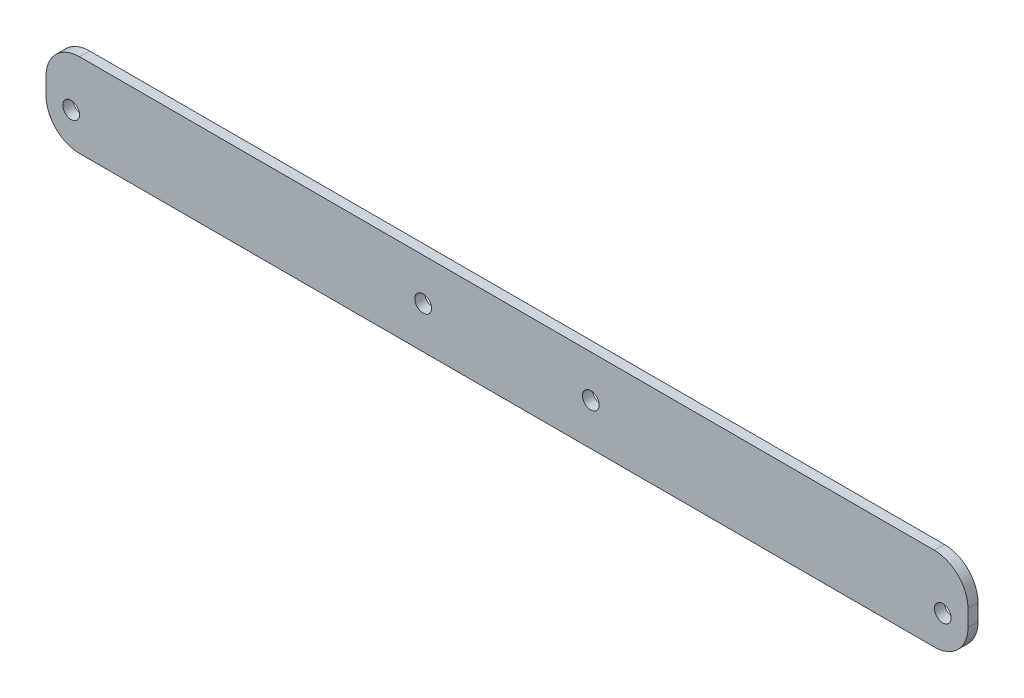
from build123d import *

# Parameters (mm, degrees)
SKETCH1_R           = 2.5
BOSS_EXTRUDE1_DEPTH = 3


with BuildPart() as part:
    # Sketch1 → Boss-Extrude1 (new body)
    with BuildSketch(Plane.XY):
        with BuildLine():
            Line((10, 0), (265, 0))
            ThreePointArc((265, 0), (272.071067812, 2.928932188), (275, 10))
            Line((275, 10), (275, 15))
            ThreePointArc((275, 15), (272.071067812, 22.071067812), (265, 25))
            Line((265, 25), (10, 25))
            ThreePointArc((10, 25), (2.928932188, 22.071067812), (0, 15))
            Line((0, 15), (0, 10))
            ThreePointArc((0, 10), (2.928932188, 2.928932188), (10, 0))
        make_face()
        with Locations((267.5, 10)):
            Circle(SKETCH1_R, mode=Mode.SUBTRACT)
        with Locations((7.5, 10)):
            Circle(SKETCH1_R, mode=Mode.SUBTRACT)
        with Locations((112.5, 12.5)):
            Circle(SKETCH1_R, mode=Mode.SUBTRACT)
        with Locations((162.5, 12.5)):
            Circle(SKETCH1_R, mode=Mode.SUBTRACT)
    extrude(amount=BOSS_EXTRUDE1_DEPTH)


solid = part.part
